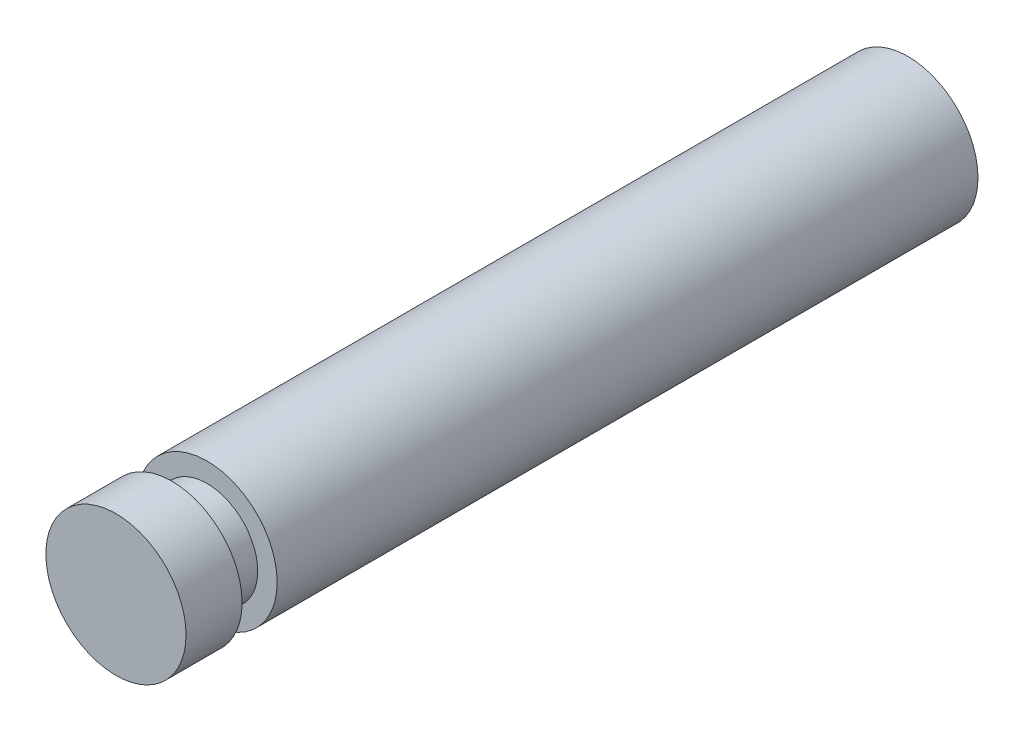
from build123d import *

# Parameters (mm, degrees)
SKETCH2_R           = 1
BOSS_EXTRUDE1_DEPTH = 10
SKETCH3_R           = 0.722538403
BOSS_EXTRUDE2_DEPTH = 0.5
SKETCH4_R           = 1
BOSS_EXTRUDE3_DEPTH = 0.8


with BuildPart() as part:
    # Sketch2 → Boss-Extrude1 (new body)
    with BuildSketch(Plane.XY):
        Circle(SKETCH2_R)
    extrude(amount=BOSS_EXTRUDE1_DEPTH)

    # Sketch3 → Boss-Extrude2 (add)
    with BuildSketch(Plane.XY.offset(10)):
        Circle(SKETCH3_R)
    extrude(amount=BOSS_EXTRUDE2_DEPTH)

    # Sketch4 → Boss-Extrude3 (add)
    with BuildSketch(Plane.XY.offset(10.5)):
        Circle(SKETCH4_R)
    extrude(amount=BOSS_EXTRUDE3_DEPTH)


solid = part.part
